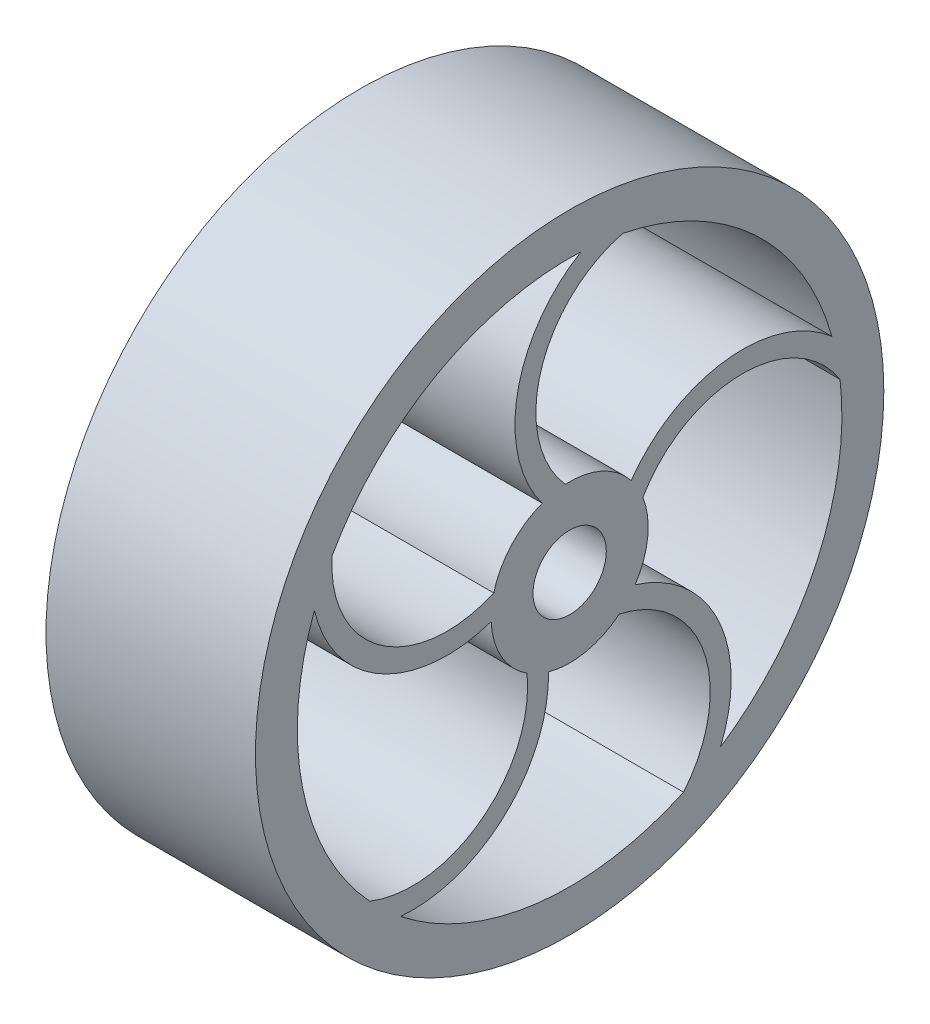
from build123d import *

# Parameters (mm, degrees)
SKETCH1_R           = 3.75
SKETCH1_R_2         = 1.75
BOSS_EXTRUDE1_DEPTH = 10
SKETCH2_R           = 15
SKETCH2_R_2         = 13
BOSS_EXTRUDE2_DEPTH = 10
BOSS_EXTRUDE3_DEPTH = 10
CIRPATTERN1_COUNT   = 5


with BuildPart() as part:
    # Sketch1 → Boss-Extrude1 (new body)
    with BuildSketch(Plane(origin=(0, 0, 0), x_dir=(0, 0, -1), z_dir=(1, 0, 0))):
        Circle(SKETCH1_R)
        Circle(SKETCH1_R_2, mode=Mode.SUBTRACT)
    extrude(amount=-BOSS_EXTRUDE1_DEPTH)



with BuildPart() as body_2:
    # Sketch2 → Boss-Extrude2 (new body)
    with BuildSketch(Plane(origin=(0, 0, 0), x_dir=(0, 0, -1), z_dir=(1, 0, 0))):
        Circle(SKETCH2_R)
        Circle(SKETCH2_R_2, mode=Mode.SUBTRACT)
    extrude(amount=-BOSS_EXTRUDE2_DEPTH)


with BuildPart() as part_1:
    add(part.part)

    add(body_2.part)  # Boss-Extrude3 merges body 2
    # Sketch3 → Boss-Extrude3 (add)
    with BuildSketch(Plane(origin=(0, 0, 0), x_dir=(0, 0, -1), z_dir=(1, 0, 0))):
        with BuildLine():
            ThreePointArc((-12.185926249, 4.528046097), (-9.008421397, 0.308117229), (-3.746637972, -0.158757395))
            ThreePointArc((-3.746637972, -0.158757395), (-3.727921816, 0.406323685), (-3.624463026, 0.962168268))
            ThreePointArc((-3.624463026, 0.962168268), (-9.003588829, 1.482702332), (-11.340490704, 6.355570045))
            ThreePointArc((-11.340490704, 6.355570045), (-11.798645456, 5.458201663), (-12.185926249, 4.528046097))
        make_face()
    boss_extrude3 = extrude(amount=-BOSS_EXTRUDE3_DEPTH)

    # CirPattern1: Boss-Extrude3 ×5 about axis
    cirpattern1_axis = Axis((0, 0, 0), (1, 0, 0))
    for i in range(1, CIRPATTERN1_COUNT):
        add(boss_extrude3.rotate(cirpattern1_axis, i * 360 / CIRPATTERN1_COUNT))


solid = part_1.part
